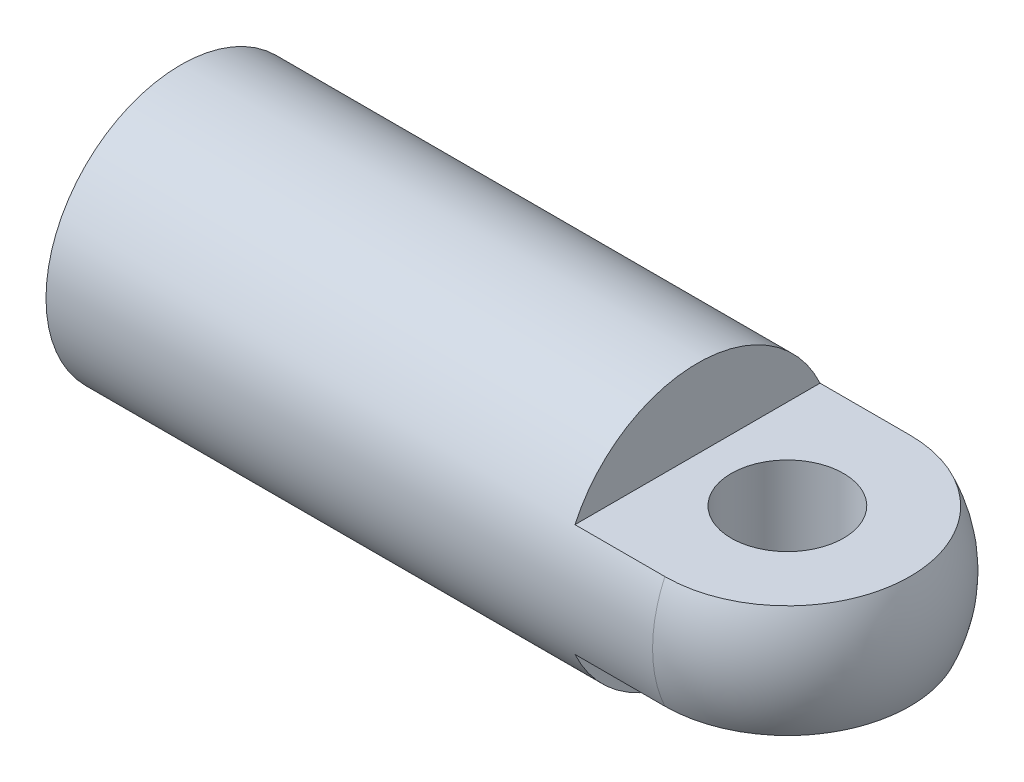
from build123d import *

# Parameters (mm, degrees)
CUT_EXTRUDE2_DEPTH      = 460.620517828
CUT_EXTRUDE2_DEPTH_BACK = 460.620517828
CUT_EXTRUDE3_DEPTH      = 476.132634543
CUT_EXTRUDE3_DEPTH_BACK = 476.132634543
SKETCH3_R               = 50


with BuildPart() as part:
    # Sketch1 → Revolve1 (revolve)
    with BuildSketch(Plane(origin=(0, 0, 0), x_dir=(1, 0, 0), z_dir=(0, 1, 0)), mode=Mode.PRIVATE) as revolve1_sk:
        with BuildLine():
            Line((-212.857142857, 80), (-232.857142857, 80))
            Line((-232.857142857, 80), (-232.857142857, 120))
            Line((-232.857142857, 120), (307.142857143, 120))
            ThreePointArc((307.142857143, 120), (391.995670885, 84.852813742), (427.142857143, 0))
            Line((427.142857143, 0), (307.142857143, 0))
            Line((307.142857143, 0), (187.142857143, 0))
            Line((187.142857143, 0), (187.142857143, 100))
            Line((187.142857143, 100), (-212.857142857, 100))
            Line((-212.857142857, 100), (-212.857142857, 80))
        make_face()
    revolve(revolve1_sk.sketch.rotate(Axis((-156.292678098, 0, 0), (1, 0, 0)), 180), axis=Axis((-156.292678098, 0, 0), (1, 0, 0)))

    # Sketch2 → Cut-Extrude2 (cut, two sides: drawn at the far end of the back side and taken through both)
    with BuildSketch(Plane.XY.offset(-CUT_EXTRUDE2_DEPTH_BACK)):
        Polygon((525.404105683, 50), (227.142857143, 50), (227.142857143, 120), (587.948795726, 120), (587.948795726, -120), (227.142857143, -120), (227.142857143, -50), (525.404105683, -50), align=None)
    extrude(amount=CUT_EXTRUDE2_DEPTH + CUT_EXTRUDE2_DEPTH_BACK, mode=Mode.SUBTRACT)

    # Sketch3 → Cut-Extrude3 (cut, two sides: drawn at the far end of the back side and taken through both)
    with BuildSketch(Plane(origin=(0, 50, 0), x_dir=(1, 0, 0), z_dir=(0, 1, 0)).offset(-CUT_EXTRUDE3_DEPTH_BACK)):
        with Locations(Location((307.142857143, 0, 0), (0, 0, 180))):
            Circle(SKETCH3_R)
    extrude(amount=CUT_EXTRUDE3_DEPTH + CUT_EXTRUDE3_DEPTH_BACK, mode=Mode.SUBTRACT)


solid = part.part
